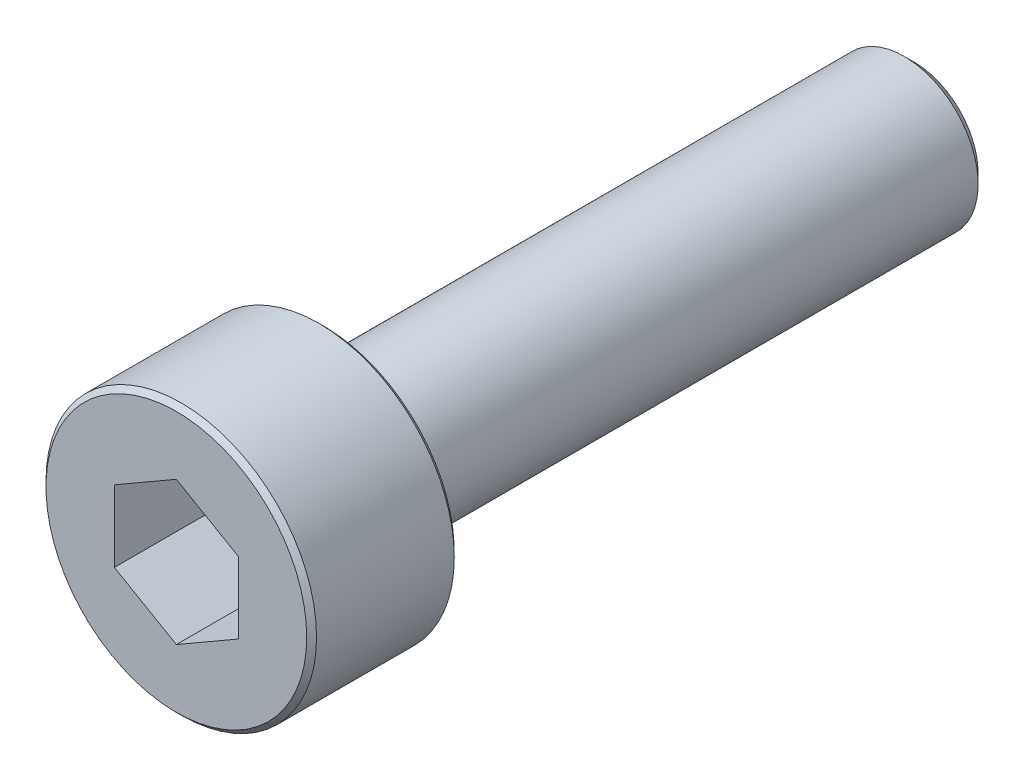
from build123d import *

# Parameters (mm, degrees)
SKETCH_1_W          = 2.75
SKETCH_1_H          = 3
SKETCH_2_R          = 1.5
EXTRUDE_1_DEPTH     = 12
CUT_EXTRUDE_1_DEPTH = 2.25
CHAMFER_1_SIZE2     = 0.100001092
CHAMFER_1_SIZE      = 0.100001016
CHAMFER_2_SIZE      = 0.200008322
CHAMFER_2_SIZE2     = 0.200009602


with BuildPart() as part:
    # 草图1 → 旋转1 (revolve)
    with BuildSketch(Plane(origin=(0, 0, 0), x_dir=(1, 0, 0), z_dir=(0, 1, 0))):
        with Locations((1.375, -13.5)):
            Rectangle(SKETCH_1_W, SKETCH_1_H)
    revolve(axis=Axis((0, 0, 12), (0, 0, 1)))

    # 草图2 → 凸台-拉伸1 (add)
    with BuildSketch(Plane(origin=(0, 0, 12), x_dir=(-1, 0, 0), z_dir=(0, 0, -1))):
        Circle(SKETCH_2_R)
    extrude(amount=EXTRUDE_1_DEPTH)

    # 草图3 → 切除-拉伸1 (cut)
    with BuildSketch(Plane.XY.offset(15)):
        Polygon((-1.26, -0.727461339), (0, -1.454922678), (1.26, -0.727461339), (1.26, 0.727461339), (0, 1.454922678), (-1.26, 0.727461339), align=None)
    extrude(amount=-CUT_EXTRUDE_1_DEPTH, mode=Mode.SUBTRACT)

    # 倒角1
    chamfer_1_edges = [part.edges().sort_by_distance(p)[0] for p in [
        (-2.75, 0, 15),
        (-2.75, 0, 12),
    ]]
    chamfer(chamfer_1_edges, length=CHAMFER_1_SIZE, length2=CHAMFER_1_SIZE2)

    # 倒角2
    chamfer_2_edges = [part.edges().sort_by_distance(p)[0] for p in [
        (1.5, 0, 0),
    ]]
    chamfer_2_side = [part.faces().sort_by_distance(p)[0] for p in [
        (1.5, 0, 6),
    ]]
    chamfer(chamfer_2_edges, length=CHAMFER_2_SIZE, length2=CHAMFER_2_SIZE2, reference=chamfer_2_side[0])


solid = part.part
